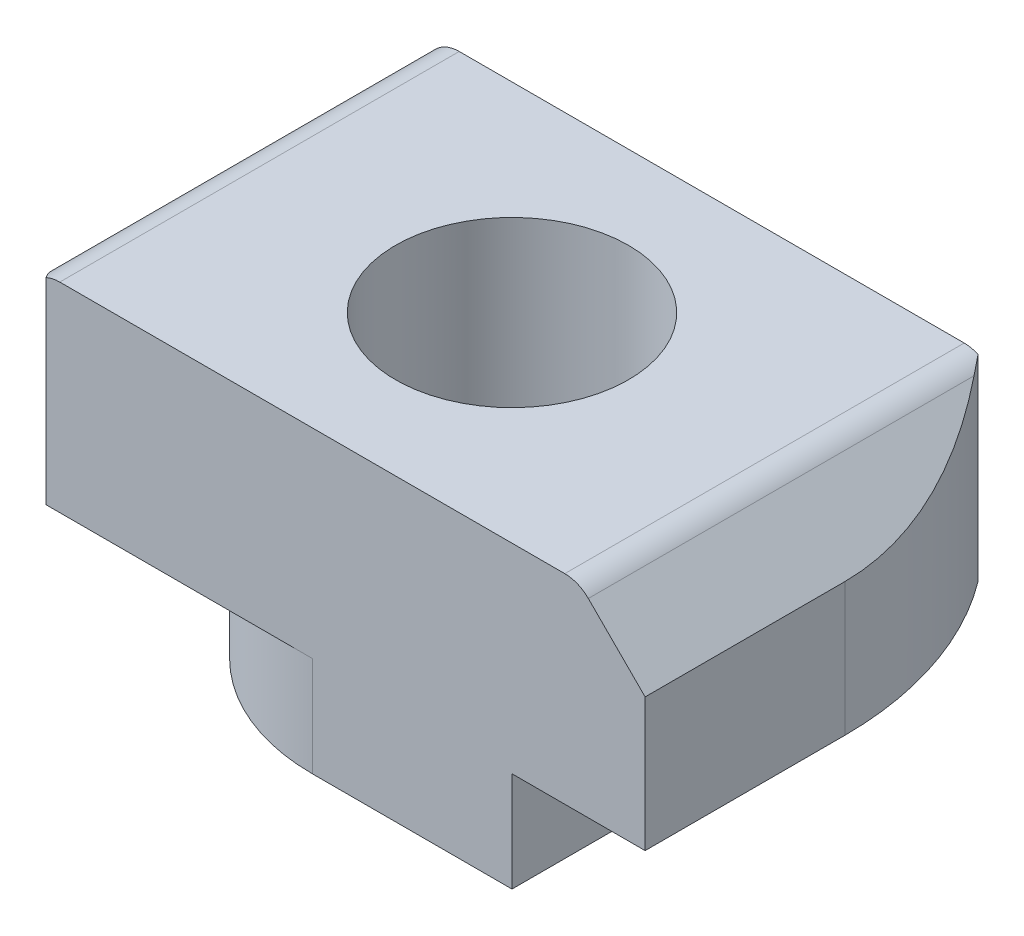
from build123d import *

# Parameters (mm, degrees)
EXTRUDE_1_DEPTH     = 3
SKETCH_2_R          = 1.75
EXTRUDE_2_DEPTH     = 1.5
SKETCH_2_2_R        = 1.75
CUT_EXTRUDE_1_DEPTH = 7.557438524
CUT_EXTRUDE_2_DEPTH = 7.557438524
FILLET_1_R          = 0.5


with BuildPart() as part:
    # Эскиз1 → Бобышка-Вытянуть1 (new, symmetric)
    with BuildSketch(Plane.XY):
        Polygon((4, 3), (5, 2), (5, 0), (0, 0), (0, 3), align=None)
    extrude_1 = extrude(amount=EXTRUDE_1_DEPTH, both=True)

    # Зеркальное отражение1: Бобышка-Вытянуть1 across plane
    add(extrude_1.mirror(Plane(origin=(0, 0, 0), x_dir=(0, 0, 1), z_dir=(1, 0, 0))))

    # Эскиз2 → Бобышка-Вытянуть2 (add)
    with BuildSketch(Plane.XZ):
        with BuildLine():
            Line((0, -3), (-3, -3))
            Line((-3, -3), (-3, 0))
            ThreePointArc((-3, 0), (-2.121320344, 2.121320344), (0, 3))
            Line((0, 3), (3, 3))
            Line((3, 3), (3, 0))
            ThreePointArc((3, 0), (2.121320344, -2.121320344), (0, -3))
        make_face()
        Circle(SKETCH_2_R, mode=Mode.SUBTRACT)
    extrude(amount=EXTRUDE_2_DEPTH)

    # Эскиз2<2> → Вырез-Вытянуть1 (cut, through all)
    with BuildSketch(Plane.XZ):
        Circle(SKETCH_2_2_R)
    extrude(amount=-CUT_EXTRUDE_1_DEPTH, mode=Mode.SUBTRACT)

    # Эскиз3 → Вырез-Вытянуть2 (cut, through all)
    with BuildSketch(Plane.XZ):
        with BuildLine():
            ThreePointArc((-5, 0), (-3.535533906, 3.535533906), (0, 5))
            Line((0, 5), (0, 5.722939185))
            Line((0, 5.722939185), (-8.00916489, 5.722939185))
            Line((-8.00916489, 5.722939185), (-8.00916489, 0))
            Line((-8.00916489, 0), (-5, 0))
        make_face()
        with BuildLine():
            Line((8.00916489, 0), (5, 0))
            ThreePointArc((5, 0), (3.535533906, -3.535533906), (0, -5))
            Line((0, -5), (0, -5.722939185))
            Line((0, -5.722939185), (8.00916489, -5.722939185))
            Line((8.00916489, -5.722939185), (8.00916489, 0))
        make_face()
    extrude(amount=-CUT_EXTRUDE_2_DEPTH, mode=Mode.SUBTRACT)

    # Скругление1
    fillet_1_edges = [part.edges().sort_by_distance(p)[0] for p in [
        (4, 3, 0),
        (-4, 3, 0),
    ]]
    fillet(fillet_1_edges, radius=FILLET_1_R)


solid = part.part
